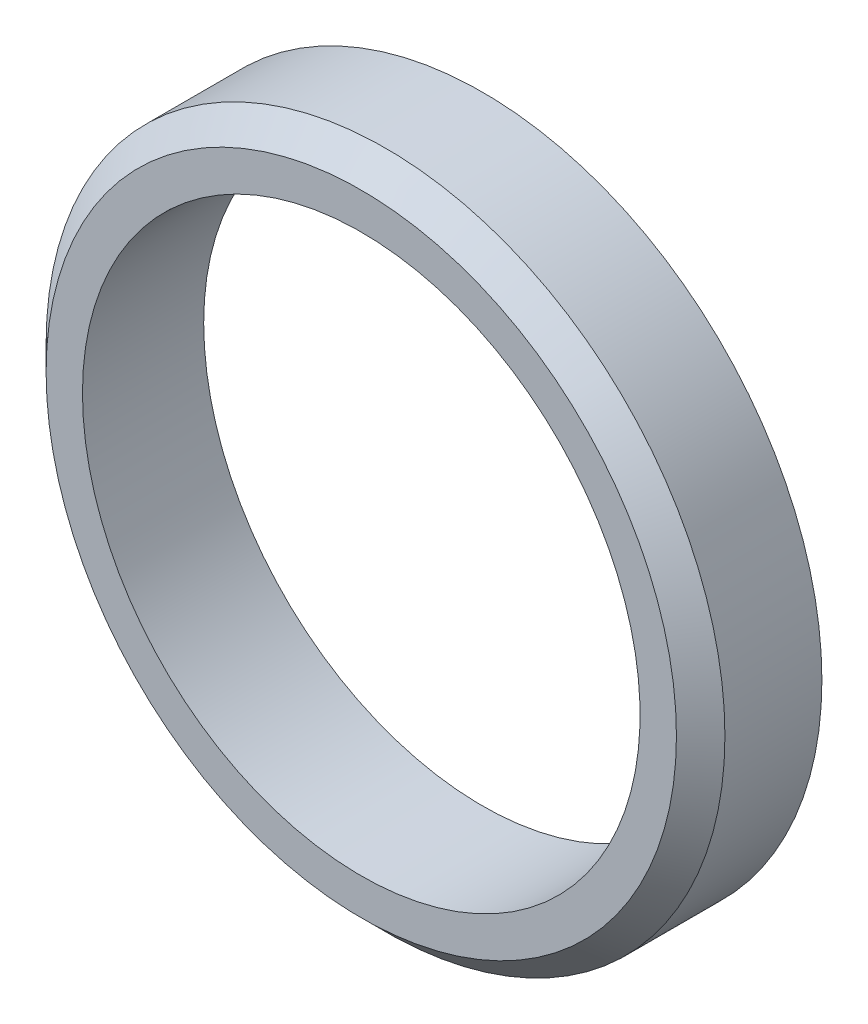
from build123d import *

# Parameters (mm, degrees)
SKETCH_1_R          = 70
EXTRUDE_1_DEPTH     = 25
CHAMFER_1_SIZE      = 5
SKETCH_2_R          = 57.5
CUT_EXTRUDE_1_DEPTH = 103.102889283


with BuildPart() as part:
    # Эскиз1 → Бобышка-Вытянуть1 (new body)
    with BuildSketch(Plane.XY):
        Circle(SKETCH_1_R)
    extrude(amount=EXTRUDE_1_DEPTH)

    # Фаска1
    chamfer_1_edges = [part.edges().sort_by_distance(p)[0] for p in [
        (-70, 0, 25),
    ]]
    chamfer(chamfer_1_edges, length=CHAMFER_1_SIZE)

    # Эскиз2 → Вырез-Вытянуть1 (cut, through all)
    with BuildSketch(Plane(origin=(0, 0, 0), x_dir=(-1, 0, 0), z_dir=(0, 0, -1))):
        Circle(SKETCH_2_R)
    extrude(amount=-CUT_EXTRUDE_1_DEPTH, mode=Mode.SUBTRACT)


solid = part.part
